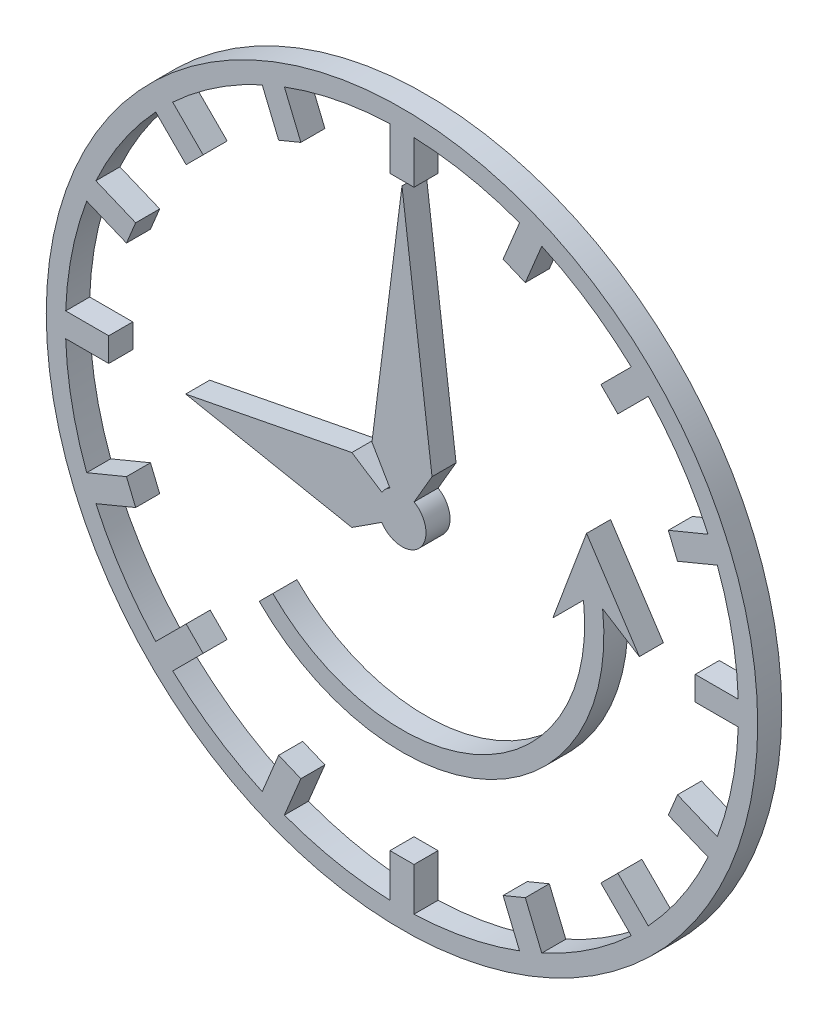
from build123d import *

# Parameters (mm, degrees)
BOSS_EXTRUDE1_DEPTH   = 0.05
BOSS_EXTRUDE1_2_DEPTH = 0.05
SKETCH1_R             = 0.74
SKETCH1_R_2           = 0.7
BOSS_EXTRUDE1_3_DEPTH = 0.05
SKETCH2_R             = 0.05
BOSS_EXTRUDE2_DEPTH   = 0.05
SKETCH3_W             = 0.05
SKETCH3_H             = 0.09
BOSS_EXTRUDE3_DEPTH   = 0.05
CIRPATTERN1_COUNT     = 16
BOSS_EXTRUDE4_DEPTH   = 0.05


with BuildPart() as part:
    # Sketch1 → Boss-Extrude1 (new body)
    with BuildSketch(Plane.XY):
        Polygon((0, 0), (0.0625, 0.107348242), (0, 0.6), (-0.0625, 0.107348242), align=None)
    extrude(amount=BOSS_EXTRUDE1_DEPTH)



with BuildPart() as body_2:
    # Sketch1 → Boss-Extrude1 2 (new body)
    with BuildSketch(Plane.XY):
        Polygon((-0.45, 0), (-0.104276771, -0.0675), (0, 0), (-0.104276771, 0.0675), align=None)
    extrude(amount=BOSS_EXTRUDE1_2_DEPTH)


with BuildPart() as body_3:
    # Sketch1 → Boss-Extrude1 3 (new body)
    with BuildSketch(Plane.XY):
        Circle(SKETCH1_R)
        Circle(SKETCH1_R_2, mode=Mode.SUBTRACT)
    extrude(amount=BOSS_EXTRUDE1_3_DEPTH)

    # Sketch3 → Boss-Extrude3 (add)
    with BuildSketch(Plane.XY.offset(0.05)):
        with Locations((0, 0.655)):
            Rectangle(SKETCH3_W, SKETCH3_H)
    boss_extrude3 = extrude(amount=-BOSS_EXTRUDE3_DEPTH)

    # CirPattern1: Boss-Extrude3 ×16 about axis
    cirpattern1_axis = Axis((0, 0, 0), (0, 0, 1))
    for i in range(1, CIRPATTERN1_COUNT):
        add(boss_extrude3.rotate(cirpattern1_axis, i * 360 / CIRPATTERN1_COUNT))


with BuildPart() as part_1:
    add(part.part)

    add(body_2.part)  # Boss-Extrude2 merges body 2
    # Sketch2 → Boss-Extrude2 (add)
    with BuildSketch(Plane.XY.offset(0.05)):
        Circle(SKETCH2_R)
    extrude(amount=-BOSS_EXTRUDE2_DEPTH)


with BuildPart() as body_3_2:
    # Sketch4 → Boss-Extrude4 (new body)
    with BuildSketch(Plane.XY.offset(0.05)):
        with BuildLine():
            Line((-0.268700577, -0.268700577), (-0.296984848, -0.296984848))
            ThreePointArc((-0.296984848, -0.296984848), (0.182179719, -0.378431698), (0.4173719, 0.046911587))
            Line((0.4173719, 0.046911587), (0.493786157, -0.001160659))
            Line((0.493786157, -0.001160659), (0.383868948, 0.165926764))
            Line((0.383868948, 0.165926764), (0.313786157, -0.021392222))
            Line((0.313786157, -0.021392222), (0.377622195, 0.042443816))
            ThreePointArc((0.377622195, 0.042443816), (0.16482927, -0.342390584), (-0.268700577, -0.268700577))
        make_face()
    extrude(amount=-BOSS_EXTRUDE4_DEPTH)


solid = Compound([body_3.part, part_1.part, body_3_2.part])
